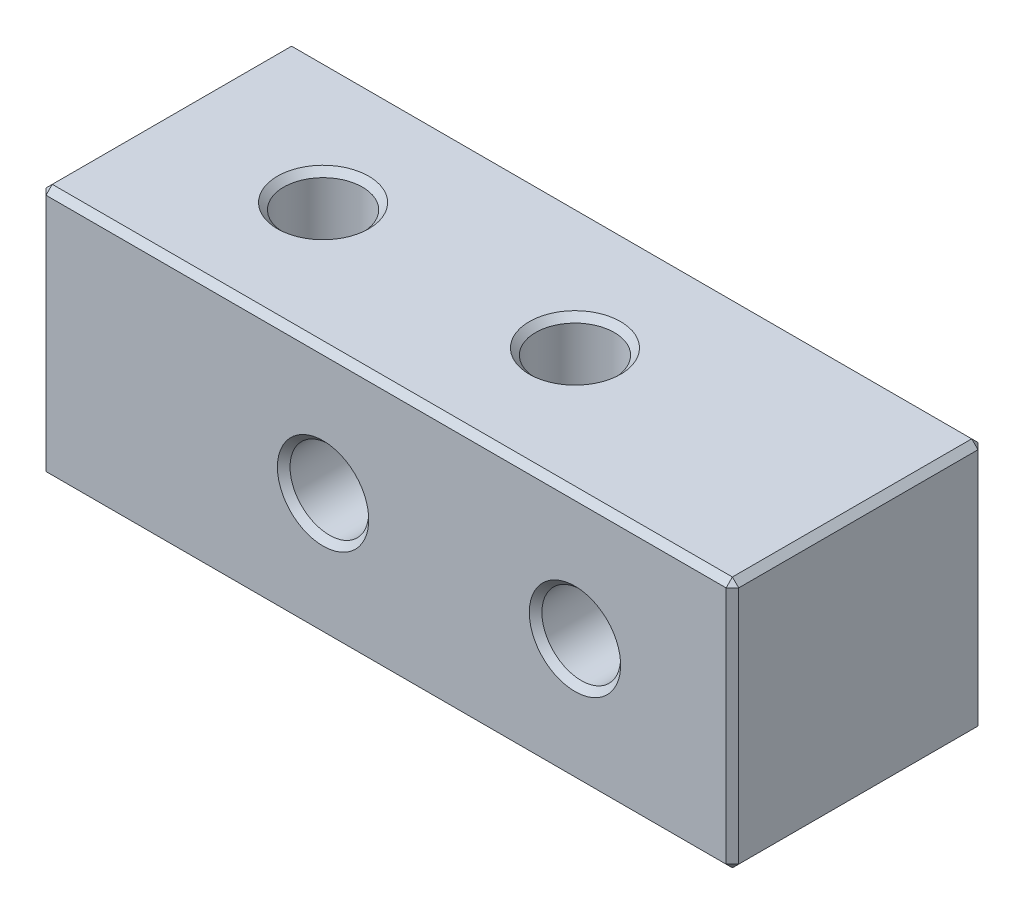
from build123d import *

# Parameters (mm, degrees)
SKETCH_1_W         = 22
SKETCH_1_H         = 8
EXTRUDE_1_DEPTH    = 4
HOLE_WIZARD_M3_1_D = 2.5
HOLE_WIZARD_M3_2_D = 2.5
CHAMFER_1_SIZE     = 0.2


with BuildPart() as part:
    # 草图1 → 凸台-拉伸1 (new, symmetric)
    with BuildSketch(Plane(origin=(0, 0, 0), x_dir=(1, 0, 0), z_dir=(0, 1, 0))):
        Rectangle(SKETCH_1_W, SKETCH_1_H)
    extrude(amount=EXTRUDE_1_DEPTH, both=True)

    # M3 螺纹孔1 (through all)
    with Locations(Plane(origin=(0, 4, 0), x_dir=(1, 0, 0), z_dir=(0, 1, 0))):
        with Locations((-6, 0), (2, 0)):
            Hole(HOLE_WIZARD_M3_1_D / 2)

    # M3 螺纹孔2 (through all)
    with Locations(Plane(origin=(0, 0, -4), x_dir=(-1, 0, 0), z_dir=(0, 0, -1))):
        with Locations((-6, 0), (2, 0)):
            Hole(HOLE_WIZARD_M3_2_D / 2)

    # 倒角1
    chamfer_1_edges = [part.edges().sort_by_distance(p)[0] for p in [
        (3.25, -4, 0),
        (-4.75, -4, 0),
        (-3.25, 0, 4),
        (4.75, 0, 4),
        (3.25, 4, 0),
        (-4.75, 4, 0),
        (-11, -4, 0),
        (11, -4, 0),
        (-11, 0, 4),
        (0, -4, 4),
        (11, 0, 4),
        (0, 4, 4),
        (-11, 4, 0),
        (11, 4, 0),
        (11, 0, -4),
        (0, 4, -4),
        (-11, 0, -4),
        (0, -4, -4),
        (-3.25, 0, -4),
        (4.75, 0, -4),
    ]]
    chamfer(chamfer_1_edges, length=CHAMFER_1_SIZE)


solid = part.part
